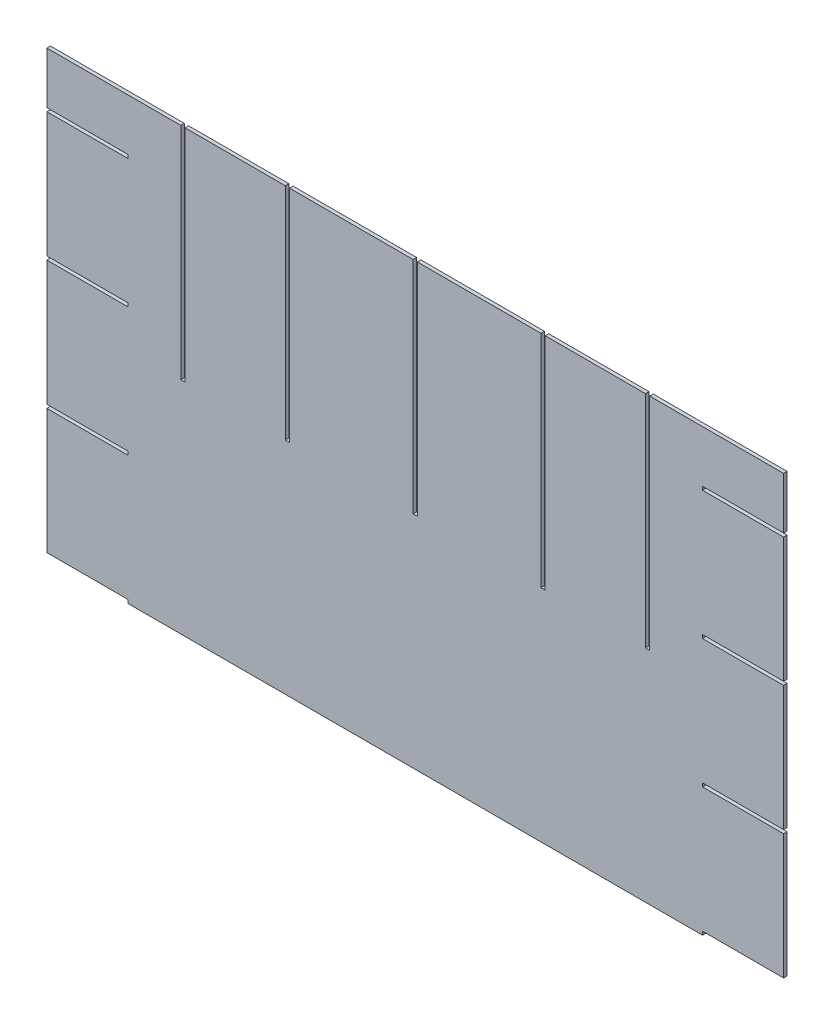
from build123d import *

# Parameters (mm, degrees)
BOSS_EXTRUDE1_DEPTH = 3


with BuildPart() as part:
    # Model → Boss-Extrude1 (new body)
    with BuildSketch(Plane.XY):
        Polygon((-315.441313755, 3), (-245.979700014, 3), (-245.979700014, 0), (245.979700014, 0), (245.979700014, 3), (315.441313755, 3), (315.441313755, 110), (245.979700014, 110), (245.979700014, 113), (315.441313755, 113), (315.441313755, 220), (245.979700014, 220), (245.979700014, 223), (315.441313755, 223), (315.441313755, 330), (245.979700014, 330), (245.979700014, 333), (315.441313755, 333), (315.441313755, 377.220662508), (200.722661623, 377.220662508), (200.722661623, 188.610331254), (197.122661623, 188.610331254), (197.122661623, 377.220662508), (111.300000002, 377.220662508), (111.300000002, 188.610331254), (107.700000002, 188.610331254), (107.700000002, 377.220662508), (1.800000002, 377.220662508), (1.800000002, 188.610331254), (-1.799999998, 188.610331254), (-1.799999998, 377.220662508), (-107.699999998, 377.220662508), (-107.699999998, 188.610331254), (-111.299999998, 188.610331254), (-111.299999998, 377.220662508), (-197.12266162, 377.220662508), (-197.12266162, 188.610331254), (-200.72266162, 188.610331254), (-200.72266162, 377.220662508), (-315.441313755, 377.220662508), (-315.441313755, 333), (-245.979700014, 333), (-245.979700014, 330), (-315.441313755, 330), (-315.441313755, 223), (-245.979700014, 223), (-245.979700014, 220), (-315.441313755, 220), (-315.441313755, 113), (-245.979700014, 113), (-245.979700014, 110), (-315.441313755, 110), align=None)
    extrude(amount=BOSS_EXTRUDE1_DEPTH)


solid = part.part
